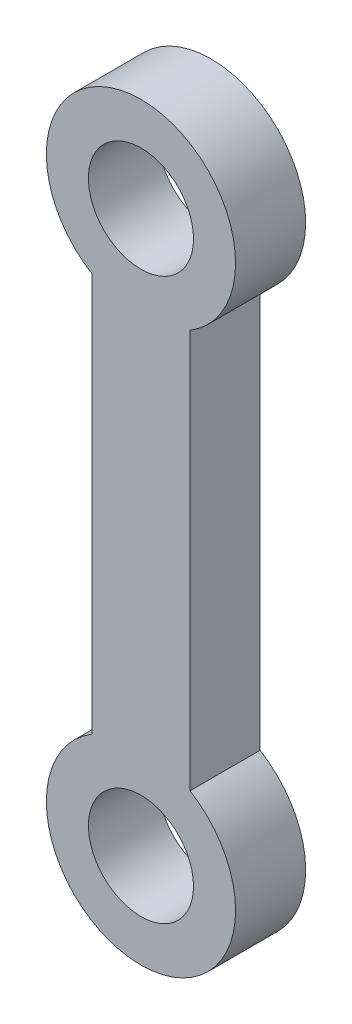
from build123d import *

# Parameters (mm, degrees)
SKETCH1_R           = 2.25
BOSS_EXTRUDE1_DEPTH = 3


with BuildPart() as part:
    # Sketch1 → Boss-Extrude1 (new body)
    with BuildSketch(Plane.XY):
        with BuildLine():
            Line((-2.287959065, 8.349022021), (-2.287959065, -8.72494015))
            ThreePointArc((-2.287959065, -8.72494015), (-0.187959065, -16.237959065), (1.912040935, -8.72494015))
            Line((1.912040935, -8.72494015), (1.912040935, 8.349022021))
            ThreePointArc((1.912040935, 8.349022021), (-0.187959065, 15.862040935), (-2.287959065, 8.349022021))
        make_face()
        with Locations((-0.187959065, 11.812040935)):
            Circle(SKETCH1_R, mode=Mode.SUBTRACT)
        with Locations((-0.187959065, -12.187959065)):
            Circle(SKETCH1_R, mode=Mode.SUBTRACT)
    extrude(amount=BOSS_EXTRUDE1_DEPTH)


solid = part.part
